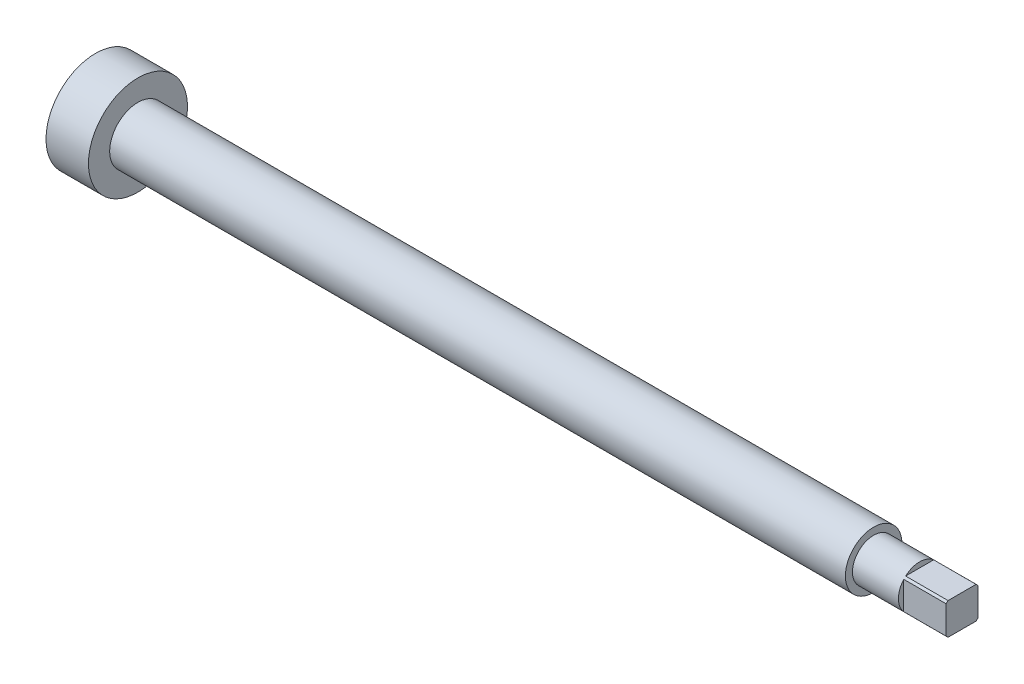
from build123d import *

# Parameters (mm, degrees)
SKETCH2_R          = 9
SKETCH2_W          = 9
SKETCH2_H          = 9
CUT_EXTRUDE1_DEPTH = 12


with BuildPart() as part:
    # Sketch1 → Revolve1 (revolve)
    with BuildSketch(Plane.XY, mode=Mode.PRIVATE) as revolve1_sk:
        Polygon((-12, 0), (-12, 14), (0, 14), (0, 8), (208, 8), (208, 6), (233, 6), (233, 0), align=None)
    revolve(revolve1_sk.sketch.rotate(Axis((500, 0, 0), (-1, 0, 0)), 270), axis=Axis((500, 0, 0), (-1, 0, 0)))

    # Sketch2 → Cut-Extrude1 (cut)
    with BuildSketch(Plane(origin=(221, 0, 0), x_dir=(0, 0, -1), z_dir=(1, 0, 0))):
        Circle(SKETCH2_R)
        Rectangle(SKETCH2_W, SKETCH2_H, mode=Mode.SUBTRACT)
    extrude(amount=CUT_EXTRUDE1_DEPTH, mode=Mode.SUBTRACT)


solid = part.part
